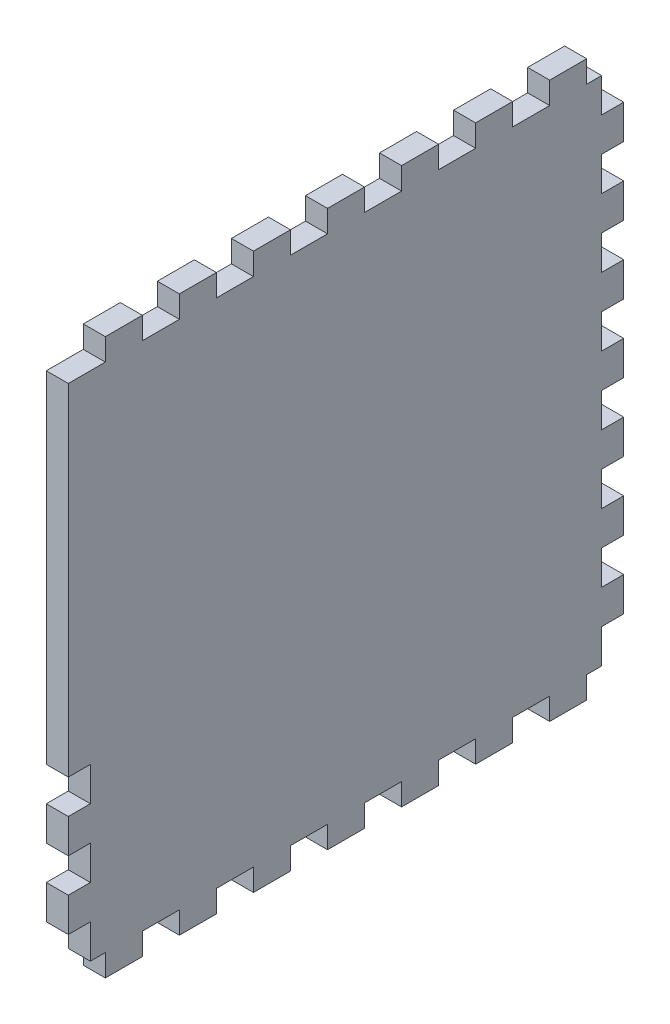
from build123d import *

# Parameters (mm, degrees)
SKETCH2_W           = 80
SKETCH2_H           = 80
BOSS_EXTRUDE1_DEPTH = 3.175
SKETCH3_OUTSIDE_W   = 104.636
SKETCH3_OUTSIDE_H   = 104.636
CUT_EXTRUDE1_DEPTH  = 57.657573413
SKETCH5_W           = 3.175000001
SKETCH5_H           = 44.189999998
BOSS_EXTRUDE3_DEPTH = 3.175


with BuildPart() as part:
    # Sketch2 → Boss-Extrude1 (new body)
    with BuildSketch(Plane(origin=(0, 0, 0), x_dir=(0, 0, -1), z_dir=(1, 0, 0))):
        Rectangle(SKETCH2_W, SKETCH2_H)
    extrude(amount=BOSS_EXTRUDE1_DEPTH)

    # Sketch3 outside → Cut-Extrude1 (cut, through all)
    with BuildSketch(Plane(origin=(3.175, 0, 0), x_dir=(0, 0, -1), z_dir=(1, 0, 0))):
        Rectangle(SKETCH3_OUTSIDE_W, SKETCH3_OUTSIDE_H)
        Polygon((-36.824999999, 36.825), (-34.666666667, 36.824999997), (-34.666666667, 39.999999997), (-29.333333333, 39.999999997), (-29.333333333, 36.824999997), (-24, 36.824999997), (-24, 40), (-18.666666667, 40), (-18.666666667, 36.825), (-13.333333333, 36.825), (-13.333333333, 40), (-8, 40), (-8, 36.825), (-2.666666667, 36.825), (-2.666666667, 40), (2.666666667, 40), (2.666666667, 36.825), (8, 36.825), (8, 40), (13.333333333, 40), (13.333333333, 36.825), (18.666666667, 36.825), (18.666666667, 40), (24, 40), (24, 36.825), (29.333333333, 36.825), (29.333333333, 40), (34.666666667, 40), (34.666666667, 36.825), (36.824999999, 36.825), (36.824999999, 31.915), (40, 31.915000001), (40, 27.005), (36.824999999, 27.005), (36.824999999, 22.095000001), (40, 22.095000001), (40, 17.185000001), (36.824999999, 17.185000001), (36.824999999, 12.275000001), (40, 12.275000001), (40, 7.365000001), (36.824999999, 7.365000001), (36.824999999, 2.455000001), (40, 2.455000002), (40, -2.454999999), (36.824999999, -2.454999999), (36.824999999, -7.364999998), (40, -7.364999998), (40, -12.274999998), (36.824999999, -12.274999998), (36.824999999, -17.184999998), (40, -17.184999998), (40, -22.094999998), (36.824999999, -22.094999998), (36.824999999, -27.004999998), (40, -27.004999997), (40, -31.914999997), (36.824999999, -31.914999997), (36.824999999, -36.824999997), (34.666666667, -36.825), (34.666666667, -40), (29.333333333, -40), (29.333333333, -36.825), (24, -36.825), (24, -40), (18.666666667, -40), (18.666666667, -36.825), (13.333333333, -36.825), (13.333333333, -40), (8, -40), (8, -36.825), (2.666666667, -36.825), (2.666666667, -40), (-2.666666667, -40), (-2.666666667, -36.825), (-8, -36.825), (-8, -40), (-13.333333333, -40), (-13.333333333, -36.825), (-18.666666667, -36.825), (-18.666666667, -40), (-24, -40), (-24, -36.824999997), (-29.333333333, -36.824999997), (-29.333333333, -39.999999997), (-34.666666667, -39.999999997), (-34.666666667, -36.824999997), (-36.825, -36.824999997), (-36.825, -31.914999997), (-40.000000001, -31.914999997), (-40.000000001, -27.004999997), (-36.825, -27.004999997), (-36.825, -22.094999998), (-40.000000001, -22.094999997), (-40.000000001, -17.184999998), (-36.825, -17.184999998), (-36.825, -12.274999998), (-40.000000001, -12.274999998), (-40, -7.364999998), (-36.825, -7.364999998), (-36.825, -2.454999999), (-40, -2.454999998), (-40, 2.455000002), (-36.825, 2.455000002), (-36.825, 7.365000001), (-40, 7.365000002), (-40, 12.275000001), (-36.825, 12.275000001), (-36.824999999, 17.185000001), (-40, 17.185000002), (-40, 22.095000001), (-36.824999999, 22.095000001), (-36.824999999, 27.005000001), (-40, 27.005000001), (-40, 31.915000001), (-36.824999999, 31.915000001), align=None, mode=Mode.SUBTRACT)
    extrude(amount=-CUT_EXTRUDE1_DEPTH, mode=Mode.SUBTRACT)

    # Sketch5 → Boss-Extrude3 (add)
    with BuildSketch(Plane.ZY):
        with Locations((38.412499999, 14.730000001)):
            Rectangle(SKETCH5_W, SKETCH5_H)
    extrude(amount=-BOSS_EXTRUDE3_DEPTH)


solid = part.part
